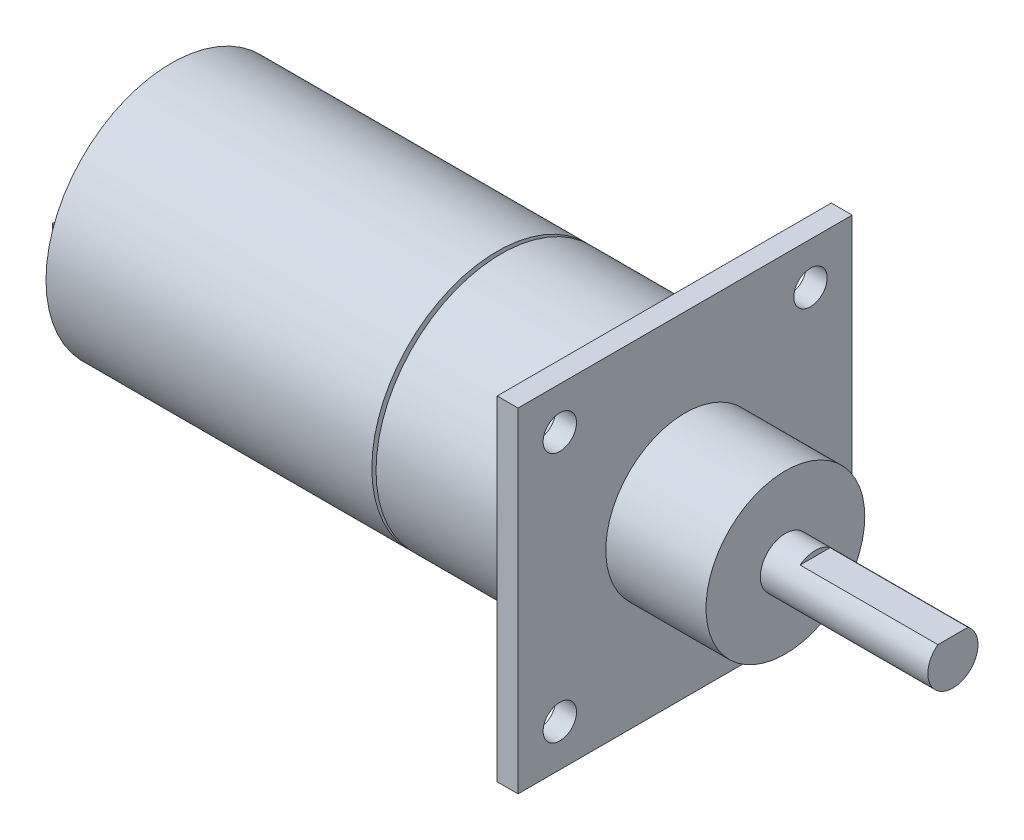
from build123d import *

# Parameters (mm, degrees)
CROQUIS2_W              = 40
CROQUIS2_H              = 40
SALIENTE_EXTRUIR1_DEPTH = 2.5
CROQUIS3_R              = 2
CORTAR_EXTRUIR1_DEPTH   = 2.5
CORTAR_EXTRUIR2_DEPTH   = 16.5
CROQUIS7_W              = 0.5
CROQUIS7_H              = 3
SALIENTE_EXTRUIR2_DEPTH = 4


with BuildPart() as part:
    # Croquis1 → Revolución1 (revolve)
    with BuildSketch(Plane.XY, mode=Mode.PRIVATE) as revoluci_n1_sk:
        Polygon((0, 0), (-93.552786405, 0), (-98.552786405, 0), (-98.552786405, 1), (-96.552786405, 1), (-96.552786405, 4), (-93.552786405, 4), (-93.552786405, 15), (-54.552786405, 15), (-54.552786405, 14), (-54.052786405, 14), (-54.052786405, 15), (-32.052786405, 15), (-32.052786405, 9.5), (-20.052786405, 9.5), (-20.052786405, 3), (0, 3), align=None)
    revolve(revoluci_n1_sk.sketch.rotate(Axis((0, 0, 0), (-1, 0, 0)), 90), axis=Axis((0, 0, 0), (-1, 0, 0)))

    # Croquis2 → Saliente-Extruir1 (add)
    with BuildSketch(Plane(origin=(-32.052786405, 0, 0), x_dir=(0, 0, -1), z_dir=(1, 0, 0))):
        Rectangle(CROQUIS2_W, CROQUIS2_H)
    extrude(amount=-SALIENTE_EXTRUIR1_DEPTH)

    # Croquis3 → Cortar-Extruir1 (cut)
    with BuildSketch(Plane(origin=(-32.052786405, 0, 0), x_dir=(0, 0, -1), z_dir=(1, 0, 0))):
        with Locations((-15, 15)):
            Circle(CROQUIS3_R)
        with Locations((15, 15)):
            Circle(CROQUIS3_R)
        with Locations((-15, -15)):
            Circle(CROQUIS3_R)
        with Locations((15, -15)):
            Circle(CROQUIS3_R)
    extrude(amount=-CORTAR_EXTRUIR1_DEPTH, mode=Mode.SUBTRACT)

    # Croquis6 → Cortar-Extruir2 (cut)
    with BuildSketch(Plane(origin=(0, 0, 0), x_dir=(0, 0, -1), z_dir=(1, 0, 0))):
        with BuildLine():
            Line((-1.8, 2.4), (0, 2.4))
            Line((0, 2.4), (1.8, 2.4))
            ThreePointArc((1.8, 2.4), (0, 3), (-1.8, 2.4))
        make_face()
    extrude(amount=-CORTAR_EXTRUIR2_DEPTH, mode=Mode.SUBTRACT)

    # Croquis7 → Saliente-Extruir2 (add)
    with BuildSketch(Plane.ZY.offset(93.552786405)):
        with Locations((-10, 0)):
            Rectangle(CROQUIS7_W, CROQUIS7_H)
        with Locations((10, 0)):
            Rectangle(CROQUIS7_W, CROQUIS7_H)
    extrude(amount=SALIENTE_EXTRUIR2_DEPTH)


solid = part.part
